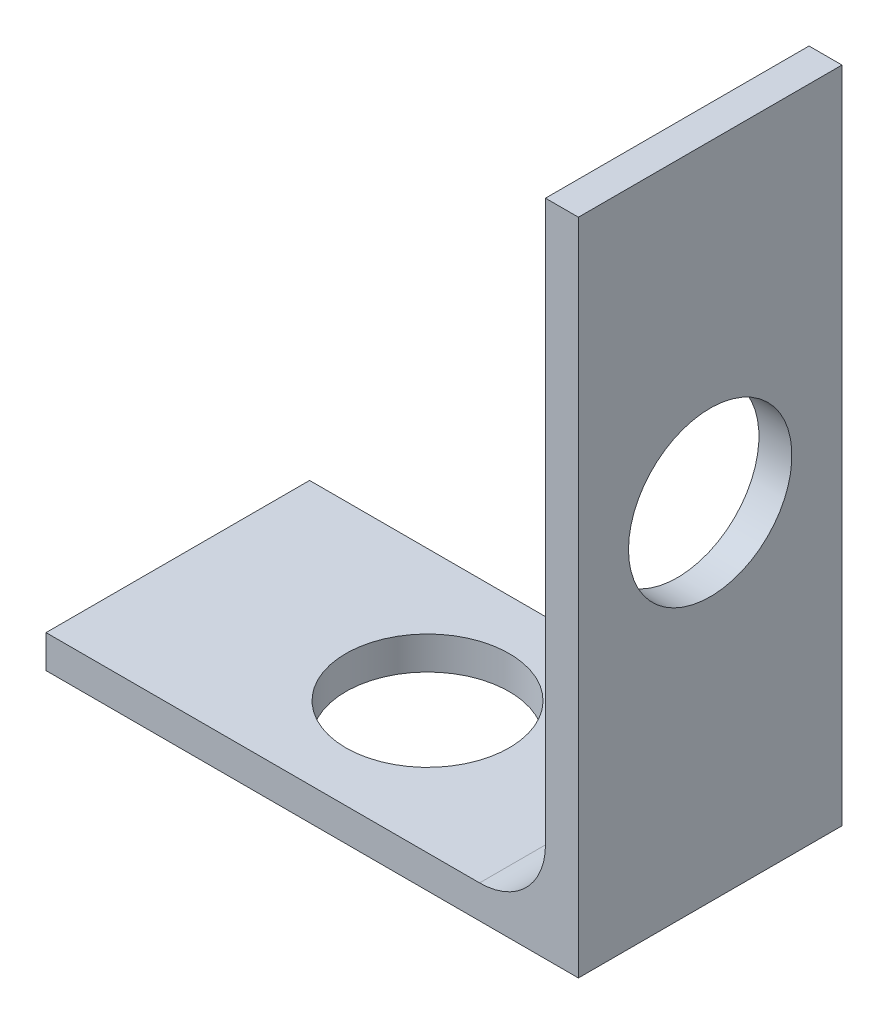
from build123d import *

# Parameters (mm, degrees)
BOSS_EXTRUDE1_DEPTH = 12.7
SKETCH2_R           = 3.937
CUT_EXTRUDE1_DEPTH  = 6.35
SKETCH4_R           = 3.937
CUT_EXTRUDE2_DEPTH  = 6.35
FILLET2_R           = 3.175


with BuildPart() as part:
    # Sketch1 → Boss-Extrude1 (new body)
    with BuildSketch(Plane.XY):
        Polygon((0, 0), (25.654, 0), (25.654, 31.75), (24.0665, 31.75), (24.0665, 1.5875), (0, 1.5875), align=None)
    extrude(amount=BOSS_EXTRUDE1_DEPTH)

    # Sketch2 → Cut-Extrude1 (cut)
    with BuildSketch(Plane.ZY.offset(-24.0665)):
        with Locations((6.35, 16.66875)):
            Circle(SKETCH2_R)
    extrude(amount=-CUT_EXTRUDE1_DEPTH, mode=Mode.SUBTRACT)

    # Sketch4 → Cut-Extrude2 (cut)
    with BuildSketch(Plane(origin=(0, 1.5875, 0), x_dir=(1, 0, 0), z_dir=(0, 1, 0))):
        with Locations(Location((12.03325, -6.35, 0), (0, 0, 270))):
            Circle(SKETCH4_R)
    extrude(amount=-CUT_EXTRUDE2_DEPTH, mode=Mode.SUBTRACT)

    # Fillet2
    fillet2_edges = [part.edges().sort_by_distance(p)[0] for p in [
        (24.0665, 1.5875, 6.35),
    ]]
    fillet(fillet2_edges, radius=FILLET2_R)


solid = part.part
